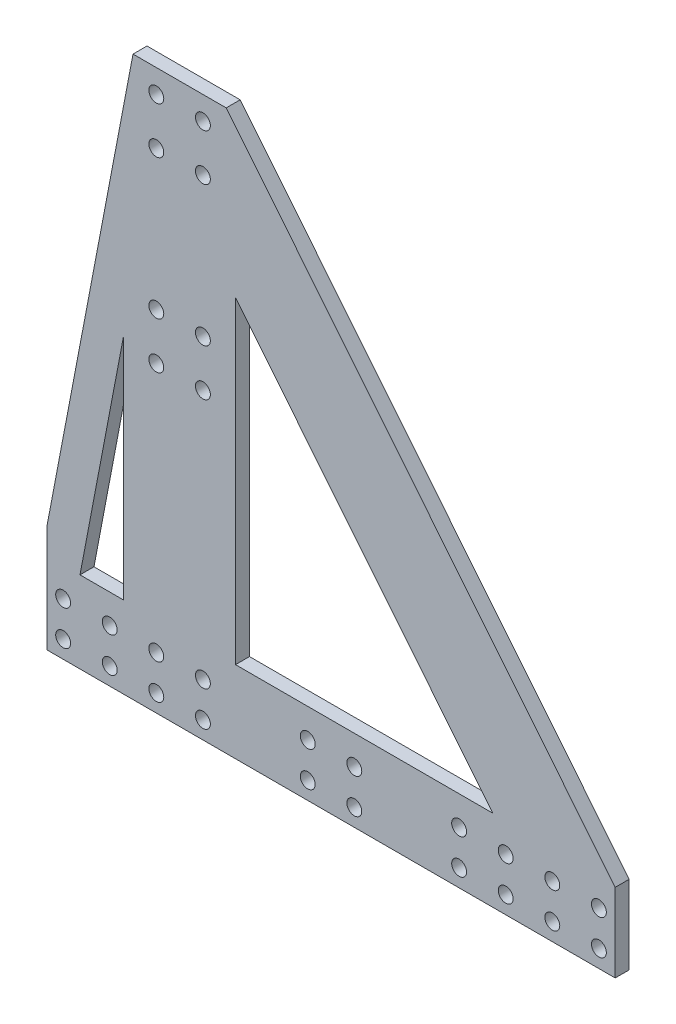
from build123d import *

# Parameters (mm, degrees)
EXTRUDE_1_DEPTH     = 3
SKETCH_2_R          = 1.6
SKETCH_2_W          = 1.5
SKETCH_2_H          = 40
CUT_EXTRUDE_1_DEPTH = 160.48040632


with BuildPart() as part:
    # 草图1 → 凸台-拉伸1 (new body)
    with BuildSketch(Plane.XY):
        Polygon((0, 0), (20, 0), (105, -105), (105, -120), (-20, -120), (-20, -105), align=None)
    extrude(amount=EXTRUDE_1_DEPTH)

    # 草图2 → 切除-拉伸1 (cut, through all)
    with BuildSketch(Plane.XY.offset(3)):
        with Locations((5, -5)):
            Circle(SKETCH_2_R)
        with Locations(Location((15, -5, 0), (0, 0, 180))):
            Circle(SKETCH_2_R)
        with Locations((15, -15)):
            Circle(SKETCH_2_R)
        with Locations(Location((5, -15, 0), (0, 0, 180))):
            Circle(SKETCH_2_R)
        with Locations((-15, -116.25)):
            Circle(SKETCH_2_R)
        with Locations(Location((-15, -108.75, 0), (0, 0, 180))):
            Circle(SKETCH_2_R)
        with Locations(Location((-5, -116.25, 0), (0, 0, 180))):
            Circle(SKETCH_2_R)
        with Locations((-5, -108.75)):
            Circle(SKETCH_2_R)
        with Locations(Location((90, -108.75, 0), (0, 0, 180))):
            Circle(SKETCH_2_R)
        with Locations((90, -116.25)):
            Circle(SKETCH_2_R)
        with Locations((100, -108.75)):
            Circle(SKETCH_2_R)
        with Locations(Location((100, -116.25, 0), (0, 0, 180))):
            Circle(SKETCH_2_R)
        with Locations((37.5, -116.25)):
            Circle(SKETCH_2_R)
        with Locations(Location((47.5, -116.25, 0), (0, 0, 180))):
            Circle(SKETCH_2_R)
        with Locations((47.5, -108.75)):
            Circle(SKETCH_2_R)
        with Locations(Location((37.5, -108.75, 0), (0, 0, 180))):
            Circle(SKETCH_2_R)
        with Locations((5, -45)):
            Circle(SKETCH_2_R)
        with Locations(Location((15, -45, 0), (0, 0, 180))):
            Circle(SKETCH_2_R)
        with Locations((15, -55)):
            Circle(SKETCH_2_R)
        with Locations(Location((5, -55, 0), (0, 0, 180))):
            Circle(SKETCH_2_R)
        with Locations(Location((5, -108.75, 0), (0, 0, 180))):
            Circle(SKETCH_2_R)
        with Locations((5, -116.25)):
            Circle(SKETCH_2_R)
        with Locations(Location((15, -116.25, 0), (0, 0, 180))):
            Circle(SKETCH_2_R)
        with Locations((15, -108.75)):
            Circle(SKETCH_2_R)
        with Locations((70, -116.25)):
            Circle(SKETCH_2_R)
        with Locations(Location((80, -116.25, 0), (0, 0, 180))):
            Circle(SKETCH_2_R)
        with Locations(Location((70, -108.75, 0), (0, 0, 180))):
            Circle(SKETCH_2_R)
        with Locations((80, -108.75)):
            Circle(SKETCH_2_R)
        Polygon((-2, -53.255116653), (-2, -102.5), (-11.37997778, -102.5), align=None)
        with Locations((104.25, -100)):
            Rectangle(SKETCH_2_W, SKETCH_2_H)
        with Locations((-19.25, -100)):
            Rectangle(SKETCH_2_W, SKETCH_2_H)
        Polygon((22, -34.257073144), (22, -102.5), (77.244274122, -102.5), align=None)
    extrude(amount=-CUT_EXTRUDE_1_DEPTH, mode=Mode.SUBTRACT)


solid = part.part
